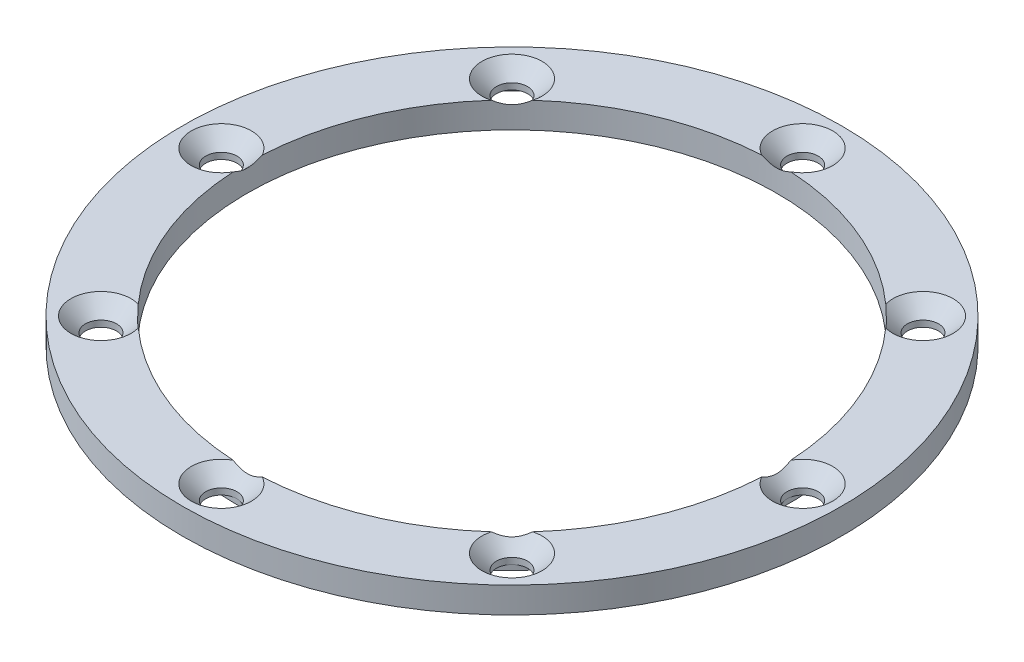
from build123d import *

# Parameters (mm, degrees)
SKETCH_1_R               = 31.75
SKETCH_1_R_2             = 25.5
EXTRUDE_1_DEPTH          = 2.5
SKETCH_2_R               = 1.5
CUT_EXTRUDE_1_DEPTH      = 10
SKETCH_3_R               = 30.1
SKETCH_3_R_2             = 26.5
CUT_EXTRUDE_2_DEPTH      = 0.5
HOLE_WIZARD_1_AT_2_COUNT = 2
HOLE_WIZARD_1_AT_2_PITCH = 21.430272212
HOLE_WIZARD_1_AT_3_COUNT = 2
HOLE_WIZARD_1_AT_3_PITCH = 39.597979746
HOLE_WIZARD_1_AT_4_COUNT = 2
HOLE_WIZARD_1_AT_4_PITCH = 51.737253821
HOLE_WIZARD_1_AT_5_COUNT = 2
HOLE_WIZARD_1_AT_5_PITCH = 56
HOLE_WIZARD_1_AT_6_COUNT = 2
HOLE_WIZARD_1_AT_6_PITCH = 39.597979746
HOLE_WIZARD_1_AT_7_COUNT = 2
HOLE_WIZARD_1_AT_7_PITCH = 21.430272212
HOLE_WIZARD_1_AT_8_COUNT = 2
HOLE_WIZARD_1_AT_8_PITCH = 51.737253821


with BuildPart() as part:
    # 草图1 → 凸台-拉伸1 (new body)
    with BuildSketch(Plane(origin=(0, 0, 0), x_dir=(1, 0, 0), z_dir=(0, 1, 0))):
        with Locations(Location((0, 0, 0), (0, 0, 270))):
            Circle(SKETCH_1_R)
        with Locations(Location((0, 0, 0), (0, 0, 270))):
            Circle(SKETCH_1_R_2, mode=Mode.SUBTRACT)
    extrude(amount=EXTRUDE_1_DEPTH)

    # 草图2 → 切除-拉伸1 (cut)
    with BuildSketch(Plane.XZ):
        with Locations(Location((0, -28, 0), (0, 0, 270))):
            Circle(SKETCH_2_R)
        with Locations(Location((-19.798989873, -19.798989873, 0), (0, 0, 270))):
            Circle(SKETCH_2_R)
        with Locations(Location((-28, 0, 0), (0, 0, 270))):
            Circle(SKETCH_2_R)
        with Locations(Location((-19.798989873, 19.798989873, 0), (0, 0, 270))):
            Circle(SKETCH_2_R)
        with Locations(Location((0, 28, 0), (0, 0, 270))):
            Circle(SKETCH_2_R)
        with Locations(Location((19.798989873, 19.798989873, 0), (0, 0, 270))):
            Circle(SKETCH_2_R)
        with Locations(Location((28, 0, 0), (0, 0, 270))):
            Circle(SKETCH_2_R)
        with Locations(Location((19.798989873, -19.798989873, 0), (0, 0, 270))):
            Circle(SKETCH_2_R)
    extrude(amount=-CUT_EXTRUDE_1_DEPTH, mode=Mode.SUBTRACT)

    # 草图3 → 切除-拉伸2 (cut)
    with BuildSketch(Plane.XZ):
        with Locations(Location((0, 0, 0), (0, 0, 270))):
            Circle(SKETCH_3_R)
        with Locations(Location((0, 0, 0), (0, 0, 270))):
            Circle(SKETCH_3_R_2, mode=Mode.SUBTRACT)
    extrude(amount=-CUT_EXTRUDE_2_DEPTH, mode=Mode.SUBTRACT)

    # 草图4 → 打孔尺寸(%根据十字)槽沉头木螺钉的类型1 (revolve, cut)
    with BuildSketch(Plane(origin=(0, 2.5, -28), x_dir=(0, 0, 1), z_dir=(1, 0, 0))):
        Polygon((0, 0), (0, 2.5), (1.5, 2.5), (1.5, 1.4), (2.9, 0), align=None)
    hole_wizard_1 = revolve(axis=Axis((0, 8.85, -28), (0, -1, 0)), mode=Mode.SUBTRACT)

    # 打孔尺寸(%根据十字)槽沉头木螺钉的类型1 at 2: 打孔尺寸(%根据十字)槽沉头木螺钉的类型1 ×2
    with Locations(*[Vector(0.9238795325112867, 0, 0.3826834323650898) * (i * HOLE_WIZARD_1_AT_2_PITCH) for i in range(1, HOLE_WIZARD_1_AT_2_COUNT)]):
        add(hole_wizard_1, mode=Mode.SUBTRACT)

    # 打孔尺寸(%根据十字)槽沉头木螺钉的类型1 at 3: 打孔尺寸(%根据十字)槽沉头木螺钉的类型1 ×2
    with Locations(*[Vector(0.7071067811865476, 0, 0.7071067811865476) * (i * HOLE_WIZARD_1_AT_3_PITCH) for i in range(1, HOLE_WIZARD_1_AT_3_COUNT)]):
        add(hole_wizard_1, mode=Mode.SUBTRACT)

    # 打孔尺寸(%根据十字)槽沉头木螺钉的类型1 at 4: 打孔尺寸(%根据十字)槽沉头木螺钉的类型1 ×2
    with Locations(*[Vector(0.3826834323650897, 0, 0.9238795325112867) * (i * HOLE_WIZARD_1_AT_4_PITCH) for i in range(1, HOLE_WIZARD_1_AT_4_COUNT)]):
        add(hole_wizard_1, mode=Mode.SUBTRACT)

    # 打孔尺寸(%根据十字)槽沉头木螺钉的类型1 at 5: 打孔尺寸(%根据十字)槽沉头木螺钉的类型1 ×2
    with Locations(*[(0, 0, i * HOLE_WIZARD_1_AT_5_PITCH) for i in range(1, HOLE_WIZARD_1_AT_5_COUNT)]):
        add(hole_wizard_1, mode=Mode.SUBTRACT)

    # 打孔尺寸(%根据十字)槽沉头木螺钉的类型1 at 6: 打孔尺寸(%根据十字)槽沉头木螺钉的类型1 ×2
    with Locations(*[Vector(-0.7071067811865476, 0, 0.7071067811865476) * (i * HOLE_WIZARD_1_AT_6_PITCH) for i in range(1, HOLE_WIZARD_1_AT_6_COUNT)]):
        add(hole_wizard_1, mode=Mode.SUBTRACT)

    # 打孔尺寸(%根据十字)槽沉头木螺钉的类型1 at 7: 打孔尺寸(%根据十字)槽沉头木螺钉的类型1 ×2
    with Locations(*[Vector(-0.9238795325112868, 0, 0.3826834323650896) * (i * HOLE_WIZARD_1_AT_7_PITCH) for i in range(1, HOLE_WIZARD_1_AT_7_COUNT)]):
        add(hole_wizard_1, mode=Mode.SUBTRACT)

    # 打孔尺寸(%根据十字)槽沉头木螺钉的类型1 at 8: 打孔尺寸(%根据十字)槽沉头木螺钉的类型1 ×2
    with Locations(*[Vector(-0.3826834323650898, 0, 0.9238795325112867) * (i * HOLE_WIZARD_1_AT_8_PITCH) for i in range(1, HOLE_WIZARD_1_AT_8_COUNT)]):
        add(hole_wizard_1, mode=Mode.SUBTRACT)


solid = part.part
